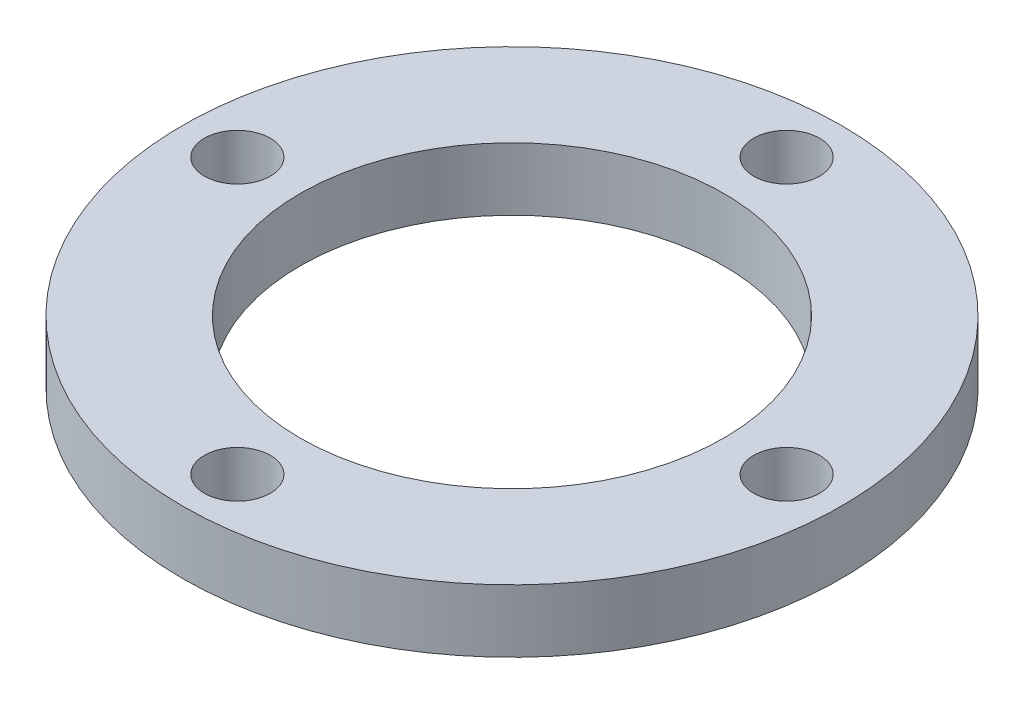
from build123d import *

# Parameters (mm, degrees)
SKETCH_2_R      = 21
SKETCH_2_R_2    = 13.5
SKETCH_2_R_3    = 2.1
EXTRUDE_1_DEPTH = 4


with BuildPart() as part:
    # 草图2 → 凸台-拉伸1 (new body)
    with BuildSketch(Plane(origin=(0, 0, 0), x_dir=(1, 0, 0), z_dir=(0, 1, 0))):
        with Locations(Location((0, 0, 0), (0, 0, 270))):
            Circle(SKETCH_2_R)
        with Locations(Location((0, 0, 0), (0, 0, 270))):
            Circle(SKETCH_2_R_2, mode=Mode.SUBTRACT)
        with Locations(Location((0, 17.5, 0), (0, 0, 270))):
            Circle(SKETCH_2_R_3, mode=Mode.SUBTRACT)
        with Locations(Location((17.5, 0, 0), (0, 0, 270))):
            Circle(SKETCH_2_R_3, mode=Mode.SUBTRACT)
        with Locations(Location((0, -17.5, 0), (0, 0, 270))):
            Circle(SKETCH_2_R_3, mode=Mode.SUBTRACT)
        with Locations(Location((-17.5, 0, 0), (0, 0, 270))):
            Circle(SKETCH_2_R_3, mode=Mode.SUBTRACT)
    extrude(amount=EXTRUDE_1_DEPTH)


solid = part.part
